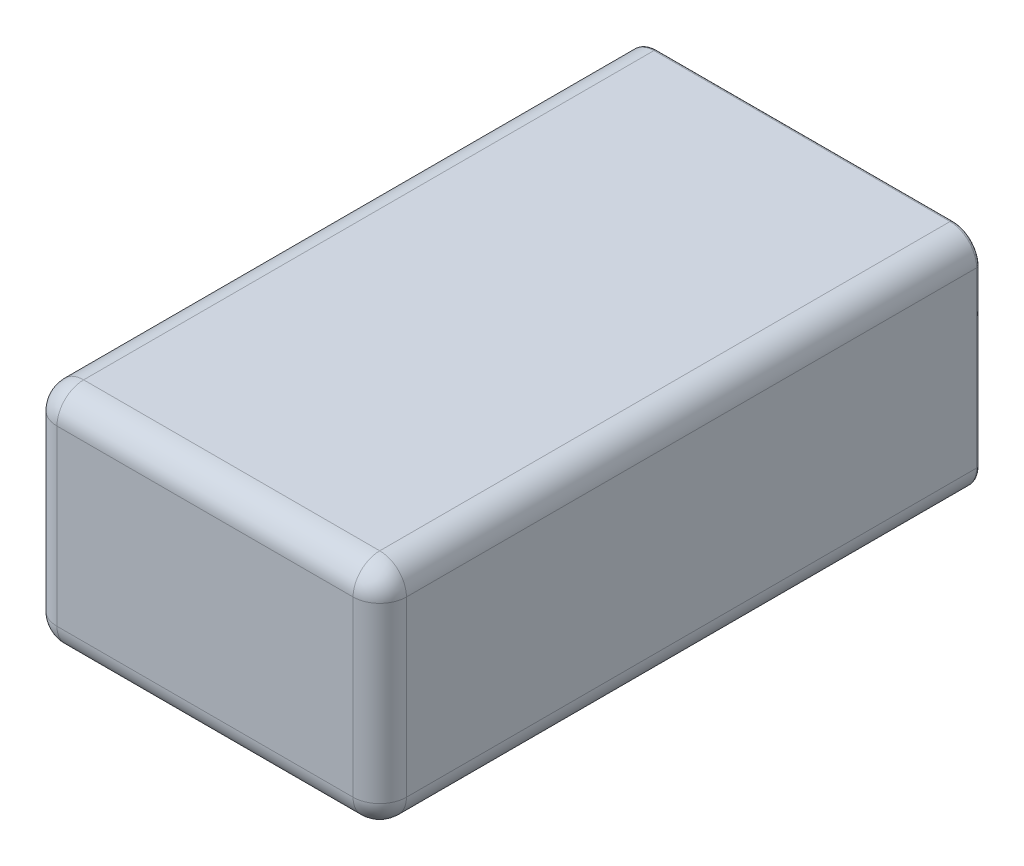
from build123d import *

# Parameters (mm, degrees)
BOSS_EXTRU_1_DEPTH      = 45
ENL_V_MAT_EXTRU_1_DEPTH = 0.5
CONG_1_R                = 0.25
CONG_2_R                = 2
ESQUISSE3_R             = 1.5
ENL_V_MAT_EXTRU_2_DEPTH = 1


with BuildPart() as part:
    # Esquisse1 → Boss.-Extru.1 (new body)
    with BuildSketch(Plane.XY):
        with BuildLine():
            Line((-11.1, 8.5), (11.1, 8.5))
            ThreePointArc((11.1, 8.5), (12.514213562, 7.914213562), (13.1, 6.5))
            Line((13.1, 6.5), (13.1, -6.5))
            ThreePointArc((13.1, -6.5), (12.514213562, -7.914213562), (11.1, -8.5))
            Line((11.1, -8.5), (-11.1, -8.5))
            ThreePointArc((-11.1, -8.5), (-12.514213562, -7.914213562), (-13.1, -6.5))
            Line((-13.1, -6.5), (-13.1, 6.5))
            ThreePointArc((-13.1, 6.5), (-12.514213562, 7.914213562), (-11.1, 8.5))
        make_face()
    extrude(amount=BOSS_EXTRU_1_DEPTH)

    # Esquisse2 → Enlèv. mat.-Extru.1 (cut)
    with BuildSketch(Plane(origin=(0, 0, 0), x_dir=(-1, 0, 0), z_dir=(0, 0, -1))):
        with BuildLine():
            Line((11.6, -6.5), (11.6, 6.5))
            ThreePointArc((11.6, 6.5), (11.453553391, 6.853553391), (11.1, 7))
            Line((11.1, 7), (-11.1, 7))
            ThreePointArc((-11.1, 7), (-11.453553391, 6.853553391), (-11.6, 6.5))
            Line((-11.6, 6.5), (-11.6, -6.5))
            ThreePointArc((-11.6, -6.5), (-11.453553391, -6.853553391), (-11.1, -7))
            Line((-11.1, -7), (11.1, -7))
            ThreePointArc((11.1, -7), (11.453553391, -6.853553391), (11.6, -6.5))
        make_face()
    extrude(amount=-ENL_V_MAT_EXTRU_1_DEPTH, mode=Mode.SUBTRACT)

    # Congé1
    cong_1_edges = [part.edges().sort_by_distance(p)[0] for p in [
        (-13.1, 0, 0),
        (-12.514213562, 7.914213562, 0),
        (-11.453553391, 6.853553391, 0),
        (0, 7, 0),
        (11.453553391, 6.853553391, 0),
        (11.6, 0, 0),
        (11.453553391, -6.853553391, 0),
        (0, -7, 0),
        (-11.453553391, -6.853553391, 0),
        (-11.6, 0, 0),
        (0, 8.5, 0),
        (12.514213562, 7.914213562, 0),
        (13.1, 0, 0),
        (12.514213562, -7.914213562, 0),
        (0, -8.5, 0),
        (-12.514213562, -7.914213562, 0),
    ]]
    fillet(cong_1_edges, radius=CONG_1_R)

    # Congé2
    cong_2_edges = [part.edges().sort_by_distance(p)[0] for p in [
        (-12.514213562, -7.914213562, 45),
        (0, -8.5, 45),
        (12.514213562, -7.914213562, 45),
        (13.1, 0, 45),
        (12.514213562, 7.914213562, 45),
        (0, 8.5, 45),
        (-12.514213562, 7.914213562, 45),
        (-13.1, 0, 45),
    ]]
    fillet(cong_2_edges, radius=CONG_2_R)

    # Esquisse3 → Enlèv. mat.-Extru.2 (cut)
    with BuildSketch(Plane(origin=(0, 0, 0.5), x_dir=(-1, 0, 0), z_dir=(0, 0, -1))):
        with Locations((-6.25, 0)):
            Circle(ESQUISSE3_R)
        with Locations((6.25, 0)):
            Circle(ESQUISSE3_R)
    extrude(amount=-ENL_V_MAT_EXTRU_2_DEPTH, mode=Mode.SUBTRACT)


solid = part.part
